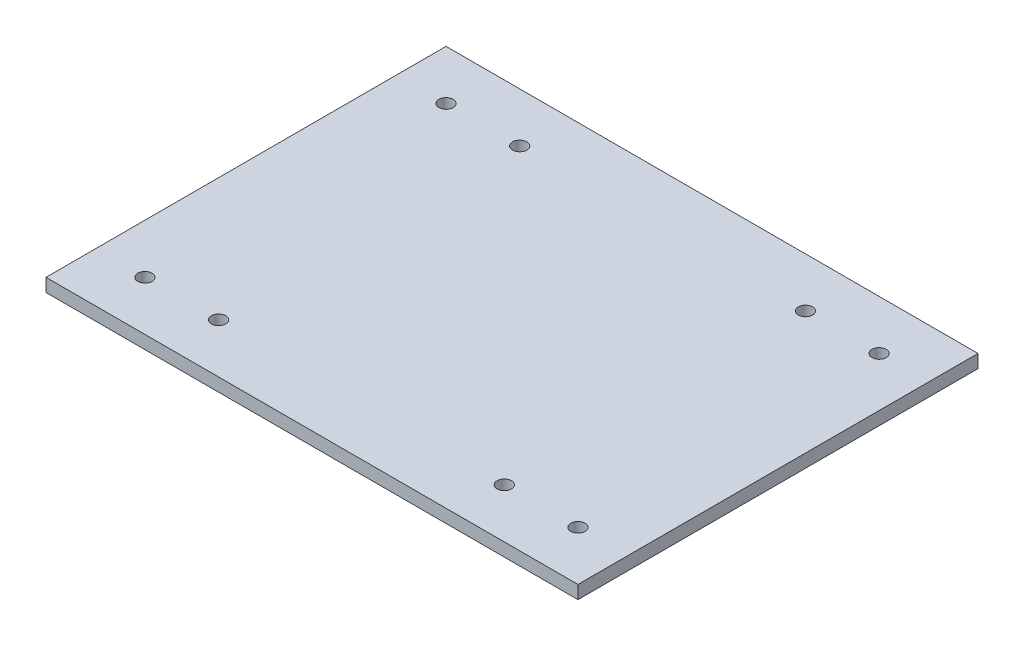
from build123d import *

# Parameters (mm, degrees)
SKETCH1_W           = 242
SKETCH1_H           = 182
SKETCH1_R           = 3.25
BOSS_EXTRUDE1_DEPTH = 6


with BuildPart() as part:
    # Sketch1 → Boss-Extrude1 (new body)
    with BuildSketch(Plane(origin=(0, 0, 0), x_dir=(1, 0, 0), z_dir=(0, 1, 0))):
        with Locations((-121, 91)):
            Rectangle(SKETCH1_W, SKETCH1_H)
        with Locations(Location((-219.5, 159.5, 0), (0, 0, 270))):
            Circle(SKETCH1_R, mode=Mode.SUBTRACT)
        with Locations(Location((-186, 159.5, 0), (0, 0, 270))):
            Circle(SKETCH1_R, mode=Mode.SUBTRACT)
        with Locations(Location((-219.5, 22.5, 0), (0, 0, 270))):
            Circle(SKETCH1_R, mode=Mode.SUBTRACT)
        with Locations(Location((-186, 22.5, 0), (0, 0, 270))):
            Circle(SKETCH1_R, mode=Mode.SUBTRACT)
        with Locations(Location((-56, 22.5, 0), (0, 0, 270))):
            Circle(SKETCH1_R, mode=Mode.SUBTRACT)
        with Locations(Location((-22.5, 22.5, 0), (0, 0, 270))):
            Circle(SKETCH1_R, mode=Mode.SUBTRACT)
        with Locations(Location((-56, 159.5, 0), (0, 0, 270))):
            Circle(SKETCH1_R, mode=Mode.SUBTRACT)
        with Locations(Location((-22.5, 159.5, 0), (0, 0, 270))):
            Circle(SKETCH1_R, mode=Mode.SUBTRACT)
    extrude(amount=BOSS_EXTRUDE1_DEPTH)


solid = part.part
